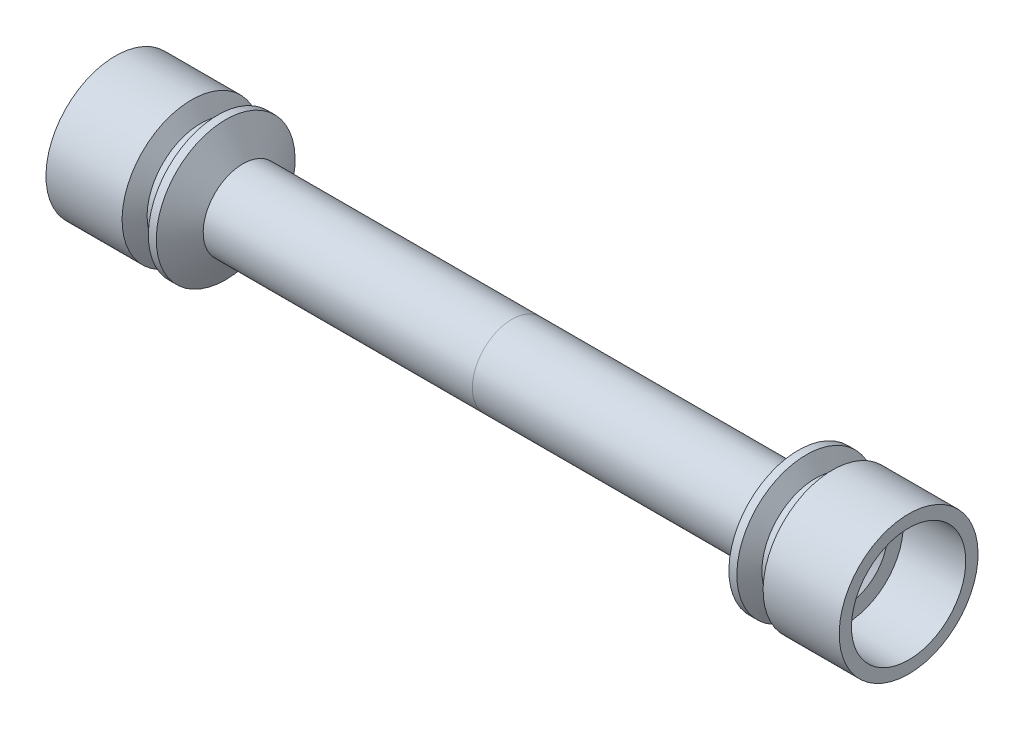
from build123d import *

# Parameters (mm, degrees)
CHAMFER1_SIZE = 0.508


with BuildPart() as part:
    # Sketch2 → Revolve1 (revolve)
    with BuildSketch(Plane.XY, mode=Mode.PRIVATE) as revolve1_sk:
        Polygon((-25.656984842, 5.55625), (-31.75, 5.55625), (-31.75, 4.575), (-26.75, 4.575), (-26.75, 3.305), (-26.242, 2.797), (-26.242, 1.7145), (-21.925, 1.7145), (-21.925, 0), (-14.1, 0), (-12.5, 1.6), (0, 1.6), (0, 3.175), (-21.54569983, 3.175), (-22.920515158, 5.55625), (-23.555515158, 5.55625), (-24.28875, 4.28625), (-24.92375, 4.28625), align=None)
    revolve(revolve1_sk.sketch.rotate(Axis((-31.75, 0, 0), (1, 0, 0)), 180), axis=Axis((-31.75, 0, 0), (1, 0, 0)))


with BuildPart() as body_2:
    # Mirror1: mirrored copy
    add(part.part.mirror(Plane(origin=(0, 0, 0), x_dir=(0, 0, 1), z_dir=(1, 0, 0))))


with BuildPart() as part_1:
    add(part.part)

    # Chamfer1
    chamfer1_edges = [part_1.edges().sort_by_distance(p)[0] for p in [
        (-31.75, 4.575, 0),
    ]]
    chamfer(chamfer1_edges, length=CHAMFER1_SIZE)


solid = Compound([body_2.part, part_1.part])
